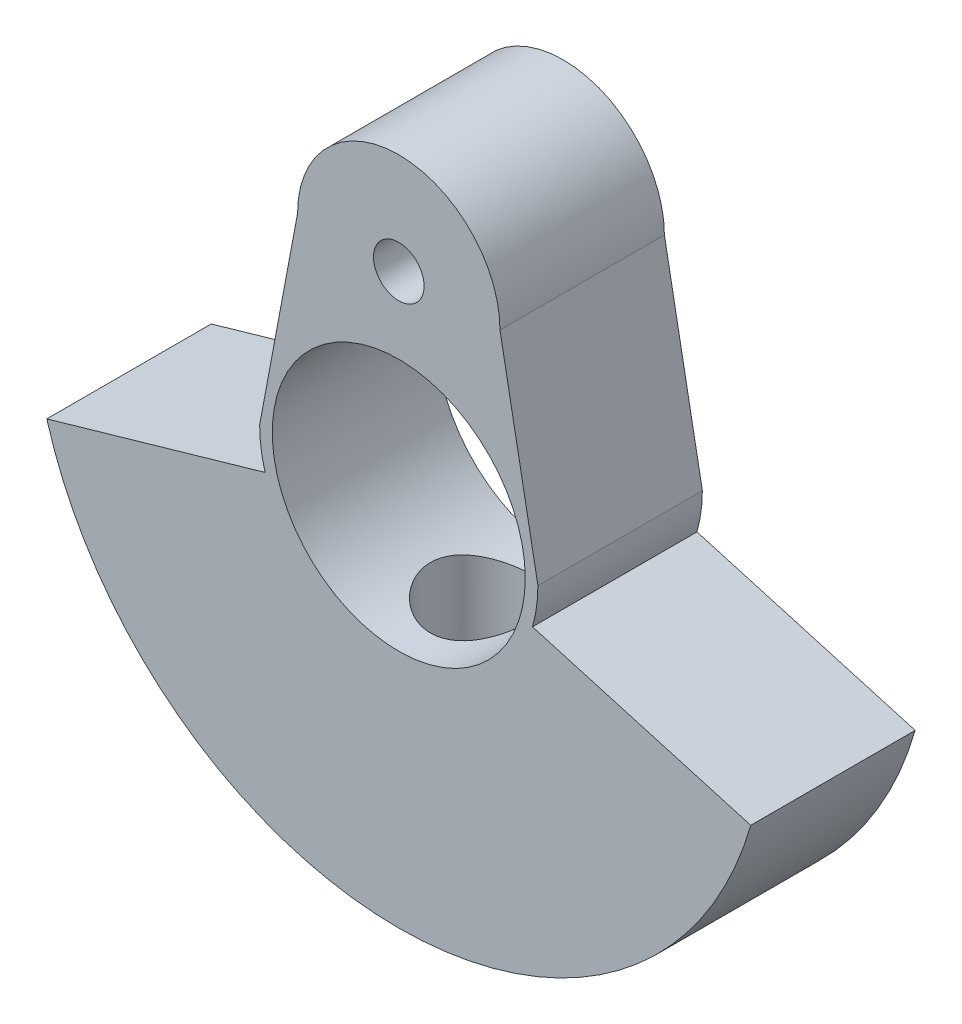
from build123d import *

# Parameters (mm, degrees)
SKETCH1_R           = 5
SKETCH1_R_2         = 1
BOSS_EXTRUDE1_DEPTH = 6.5
SKETCH5_W           = 2
SKETCH5_H           = 14.476636654


with BuildPart() as part:
    # Sketch1 → Boss-Extrude1 (new body)
    with BuildSketch(Plane.XY):
        with BuildLine():
            Line((13.913051744, -4), (5.285881411, -1.519690003))
            ThreePointArc((5.285881411, -1.519690003), (5.446207293, -0.767350063), (5.5, 0))
            Line((5.5, 0), (4, 8))
            ThreePointArc((4, 8), (0, 12), (-4, 8))
            Line((-4, 8), (-5.5, 0))
            ThreePointArc((-5.5, 0), (-5.446207293, -0.767350063), (-5.285881411, -1.519690003))
            Line((-5.285881411, -1.519690003), (-13.913051744, -4))
            ThreePointArc((-13.913051744, -4), (0, -14.476636654), (13.913051744, -4))
        make_face()
        with Locations(Location((0, 0, 0), (0, 0, 180))):
            Circle(SKETCH1_R, mode=Mode.SUBTRACT)
        with Locations(Location((0, 8, 0), (0, 0, 180))):
            Circle(SKETCH1_R_2, mode=Mode.SUBTRACT)
    extrude(amount=BOSS_EXTRUDE1_DEPTH)

    # Sketch5 → Ø4.0 (4) Diameter Hole1 (revolve, cut)
    with BuildSketch(Plane(origin=(0, 0, 3.25), x_dir=(0, 0, 1), z_dir=(1, 0, 0))):
        with Locations((1, 7.238318327)):
            Rectangle(SKETCH5_W, SKETCH5_H)
    revolve(axis=Axis((0, 6.35, 3.25), (0, -1, 0)), mode=Mode.SUBTRACT)


solid = part.part
